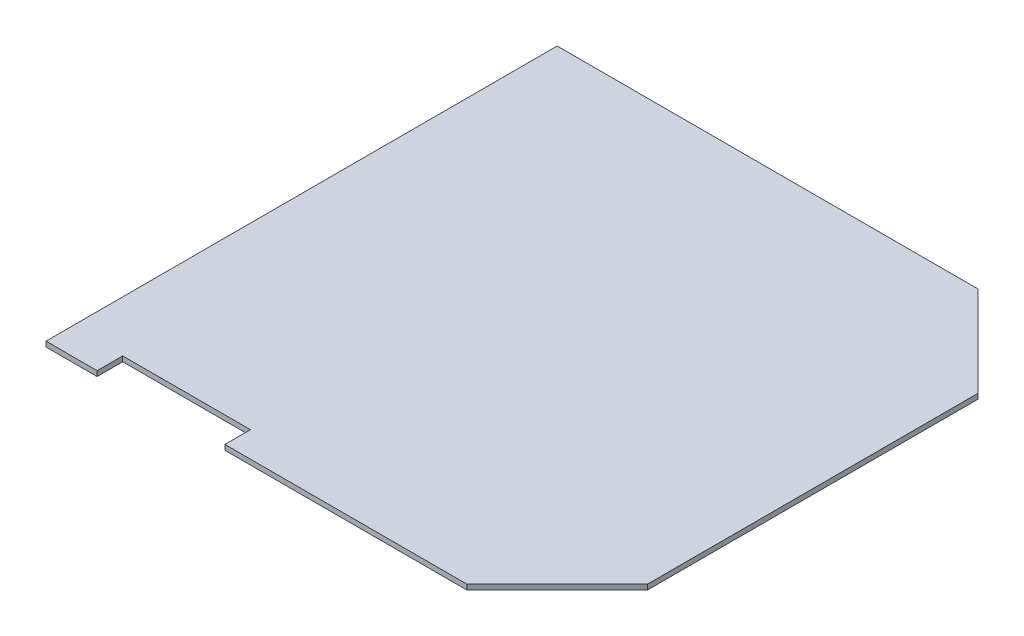
from build123d import *

# Parameters (mm, degrees)
BOSS_EXTRUDE1_DEPTH = 2
SKETCH2_W           = 50
SKETCH2_H           = 10
CUT_EXTRUDE1_DEPTH  = 155.441036988


with BuildPart() as part:
    # Sketch1 → Boss-Extrude1 (new body)
    with BuildSketch(Plane(origin=(0, 0, 0), x_dir=(1, 0, 0), z_dir=(0, 1, 0))):
        Polygon((-82.32233047, 100), (82.32233047, 100), (117.67766953, 64.644660941), (117.67766953, -64.644660941), (82.32233047, -100), (-82.32233047, -100), align=None)
    extrude(amount=BOSS_EXTRUDE1_DEPTH)

    # Sketch2 → Cut-Extrude1 (cut, through all)
    with BuildSketch(Plane(origin=(0, 2, 0), x_dir=(1, 0, 0), z_dir=(0, 1, 0))):
        with Locations((-37.32233047, -95)):
            Rectangle(SKETCH2_W, SKETCH2_H)
    extrude(amount=-CUT_EXTRUDE1_DEPTH, mode=Mode.SUBTRACT)


solid = part.part
